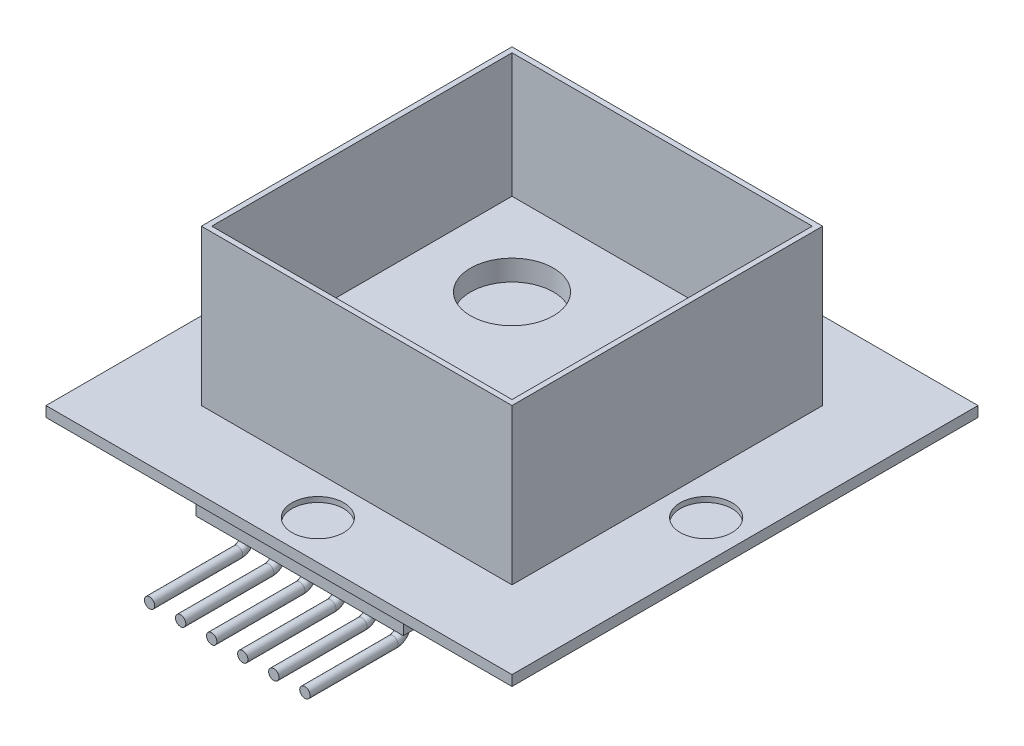
from build123d import *

# Parameters (mm, degrees)
SKETCH1_W           = 45
SKETCH1_H           = 45
BOSS_EXTRUDE1_DEPTH = 1
SKETCH2_W           = 30
SKETCH2_H           = 30
SKETCH2_W_2         = 29
SKETCH2_H_2         = 29
BOSS_EXTRUDE2_DEPTH = 15
SKETCH3_W           = 29
SKETCH3_H           = 29
BOSS_EXTRUDE3_DEPTH = 3
SKETCH4_R           = 4
CUT_EXTRUDE1_DEPTH  = 2
SKETCH5_R           = 2.5
CUT_EXTRUDE2_DEPTH  = 0.5
SKETCH7_W           = 20
SKETCH7_H           = 5
BOSS_EXTRUDE4_DEPTH = 3
SKETCH9_R           = 0.5
LPATTERN1_COUNT     = 6
LPATTERN1_PITCH     = 3


with BuildPart() as part:
    # Sketch1 → Boss-Extrude1 (new body)
    with BuildSketch(Plane(origin=(0, 0, 0), x_dir=(1, 0, 0), z_dir=(0, 1, 0))):
        with Locations((22.5, 22.5)):
            Rectangle(SKETCH1_W, SKETCH1_H)
    extrude(amount=BOSS_EXTRUDE1_DEPTH)

    # Sketch2 → Boss-Extrude2 (add)
    with BuildSketch(Plane(origin=(0, 1, 0), x_dir=(1, 0, 0), z_dir=(0, 1, 0))):
        with Locations((22.5, 22.5)):
            Rectangle(SKETCH2_W, SKETCH2_H)
        with Locations((22.5, 22.5)):
            Rectangle(SKETCH2_W_2, SKETCH2_H_2, mode=Mode.SUBTRACT)
    extrude(amount=BOSS_EXTRUDE2_DEPTH)

    # Sketch3 → Boss-Extrude3 (add)
    with BuildSketch(Plane(origin=(0, 1, 0), x_dir=(1, 0, 0), z_dir=(0, 1, 0))):
        with Locations((22.5, 22.5)):
            Rectangle(SKETCH3_W, SKETCH3_H)
    extrude(amount=BOSS_EXTRUDE3_DEPTH)

    # Sketch4 → Cut-Extrude1 (cut)
    with BuildSketch(Plane(origin=(0, 4, 0), x_dir=(1, 0, 0), z_dir=(0, 1, 0))):
        with Locations(Location((16, 29, 0), (0, 0, 270))):
            Circle(SKETCH4_R)
        with Locations(Location((29, 29, 0), (0, 0, 270))):
            Circle(SKETCH4_R)
        with Locations(Location((29, 16, 0), (0, 0, 270))):
            Circle(SKETCH4_R)
        with Locations(Location((16, 16, 0), (0, 0, 270))):
            Circle(SKETCH4_R)
    extrude(amount=-CUT_EXTRUDE1_DEPTH, mode=Mode.SUBTRACT)

    # Sketch5 → Cut-Extrude2 (cut)
    with BuildSketch(Plane(origin=(0, 1, 0), x_dir=(1, 0, 0), z_dir=(0, 1, 0))):
        with Locations(Location((41.25, 22.5, 0), (0, 0, 270))):
            Circle(SKETCH5_R)
        with Locations(Location((22.5, 41.25, 0), (0, 0, 270))):
            Circle(SKETCH5_R)
        with Locations(Location((3.75, 22.5, 0), (0, 0, 270))):
            Circle(SKETCH5_R)
        with Locations(Location((22.5, 3.75, 0), (0, 0, 270))):
            Circle(SKETCH5_R)
    extrude(amount=-CUT_EXTRUDE2_DEPTH, mode=Mode.SUBTRACT)

    # Sketch7 → Boss-Extrude4 (add)
    with BuildSketch(Plane.XZ):
        with Locations((22.5, -4.5)):
            Rectangle(SKETCH7_W, SKETCH7_H)
    extrude(amount=BOSS_EXTRUDE4_DEPTH)

    # Sweep1: sweep along a path in Sketch8
    with BuildLine(Plane.ZY.offset(-15)) as sweep1_path:
        Line((-4.5, -3), (-4.5, -4.5))
        ThreePointArc((-4.5, -4.5), (-4.207106781, -5.207106781), (-3.5, -5.5))
        Line((-3.5, -5.5), (5, -5.5))
    # Sketch9 → Sweep1 (sweep)
    with BuildSketch(Plane(origin=(15, -5.5, 5), x_dir=(1, 0, 0), z_dir=(0, 0, 1))):
        Circle(SKETCH9_R)
    sweep1 = sweep(path=sweep1_path.line)

    # LPattern1: Sweep1 ×6
    with Locations(*[(i * LPATTERN1_PITCH, 0, 0) for i in range(1, LPATTERN1_COUNT)]):
        add(sweep1)


solid = part.part
